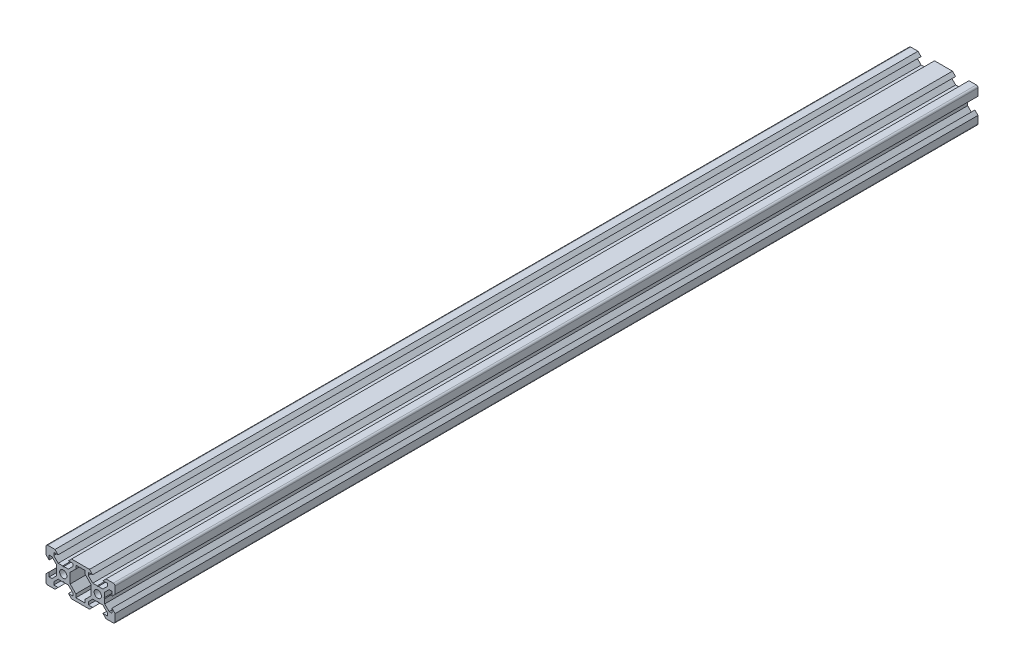
from build123d import *

# Parameters (mm, degrees)
RESSALTO_EXTRUS_O1_DEPTH = 500
CANAL_DEPTH              = 800
ESBO_O2_5_R              = 2.1
FURO_DEPTH               = 501.49975025
CORTE_EXTRUS_O4_DEPTH    = 501.49975025
PADR_OCIRCULAR2_COUNT    = 3
PADR_OCIRCULAR2_ANGLE    = 180
ESPELHAR2_COPY_1_DEPTH   = 800
ESPELHAR2_COPY_2_DEPTH   = 800


with BuildPart() as part:
    # Esboço1 → Ressalto-extrusão1 (new body)
    with BuildSketch(Plane.XY):
        with BuildLine():
            Line((-19, 10), (19, 10))
            ThreePointArc((19, 10), (19.707106781, 9.707106781), (20, 9))
            Line((20, 9), (20, -9))
            ThreePointArc((20, -9), (19.707106781, -9.707106781), (19, -10))
            Line((19, -10), (-19, -10))
            ThreePointArc((-19, -10), (-19.707106781, -9.707106781), (-20, -9))
            Line((-20, -9), (-20, 9))
            ThreePointArc((-20, 9), (-19.707106781, 9.707106781), (-19, 10))
        make_face()
    extrude(amount=RESSALTO_EXTRUS_O1_DEPTH)

    # Esboço2 → CANAL (cut)
    with BuildSketch(Plane.XY.offset(500)):
        Polygon((-14.8, 10), (-13, 8.2), (-15.5, 8.2), (-15.5, 6.560660172), (-12.939339828, 4), (-10.3, 4), (-10, 3.7), (-9.7, 4), (-7.060660172, 4), (-4.5, 6.560660172), (-4.5, 8.2), (-7, 8.2), (-5.2, 10), align=None)
    canal = extrude(amount=-CANAL_DEPTH, mode=Mode.SUBTRACT)

    # Esboço2<5> → FURO (cut, through all)
    with BuildSketch(Plane.XY.offset(500)):
        with Locations((-10, 0)):
            Circle(ESBO_O2_5_R)
    furo = extrude(amount=-FURO_DEPTH, mode=Mode.SUBTRACT)

    # Esboço2<6> → Corte-extrusão4 (cut, through all)
    with BuildSketch(Plane.XY.offset(500)):
        Polygon((-2.7, 8.2), (-2.7, 6.239339828), (-6, 2.939339828), (-6, 0), (6, 0), (6, 2.939339828), (2.7, 6.239339828), (2.7, 8.2), align=None)
    corte_extrus_o4 = extrude(amount=-CORTE_EXTRUS_O4_DEPTH, mode=Mode.SUBTRACT)

    # PadrãoCircular2: CANAL ×3 about axis
    padr_ocircular2_axis = Axis((-10, 0, 0), (0, 0, 1))
    for i in range(1, PADR_OCIRCULAR2_COUNT):
        add(canal.rotate(padr_ocircular2_axis, i * PADR_OCIRCULAR2_ANGLE / (PADR_OCIRCULAR2_COUNT - 1)), mode=Mode.SUBTRACT)

    # Espelhar2: CANAL, FURO, Corte-extrusão4 across plane
    add(canal.mirror(Plane(origin=(0, 0, 0), x_dir=(0, 0, 1), z_dir=(1, 0, 0))), mode=Mode.SUBTRACT)
    add(furo.mirror(Plane(origin=(0, 0, 0), x_dir=(0, 0, 1), z_dir=(1, 0, 0))), mode=Mode.SUBTRACT)
    add(corte_extrus_o4.mirror(Plane(origin=(0, 0, 0), x_dir=(0, 0, 1), z_dir=(1, 0, 0))), mode=Mode.SUBTRACT)

    # Espelhar2 copy 1 sketch → Espelhar2 copy 1 (cut)
    with BuildSketch(Plane(origin=(10, 10, 500), x_dir=(0, 1, 0), z_dir=(0, 0, 1))):
        Polygon((-14.8, -10), (-13, -8.2), (-15.5, -8.2), (-15.5, -6.560660172), (-12.939339828, -4), (-10.3, -4), (-10, -3.7), (-9.7, -4), (-7.060660172, -4), (-4.5, -6.560660172), (-4.5, -8.2), (-7, -8.2), (-5.2, -10), align=None)
    extrude(amount=-ESPELHAR2_COPY_1_DEPTH, mode=Mode.SUBTRACT)

    # Espelhar2 copy 2 sketch → Espelhar2 copy 2 (cut)
    with BuildSketch(Plane(origin=(20, 0, 500), x_dir=(1, 0, 0), z_dir=(0, 0, 1))):
        Polygon((-14.8, -10), (-13, -8.2), (-15.5, -8.2), (-15.5, -6.560660172), (-12.939339828, -4), (-10.3, -4), (-10, -3.7), (-9.7, -4), (-7.060660172, -4), (-4.5, -6.560660172), (-4.5, -8.2), (-7, -8.2), (-5.2, -10), align=None)
    extrude(amount=-ESPELHAR2_COPY_2_DEPTH, mode=Mode.SUBTRACT)

    # Espelhar3: Corte-extrusão4 across plane
    add(corte_extrus_o4.mirror(Plane.ZX), mode=Mode.SUBTRACT)


solid = part.part
